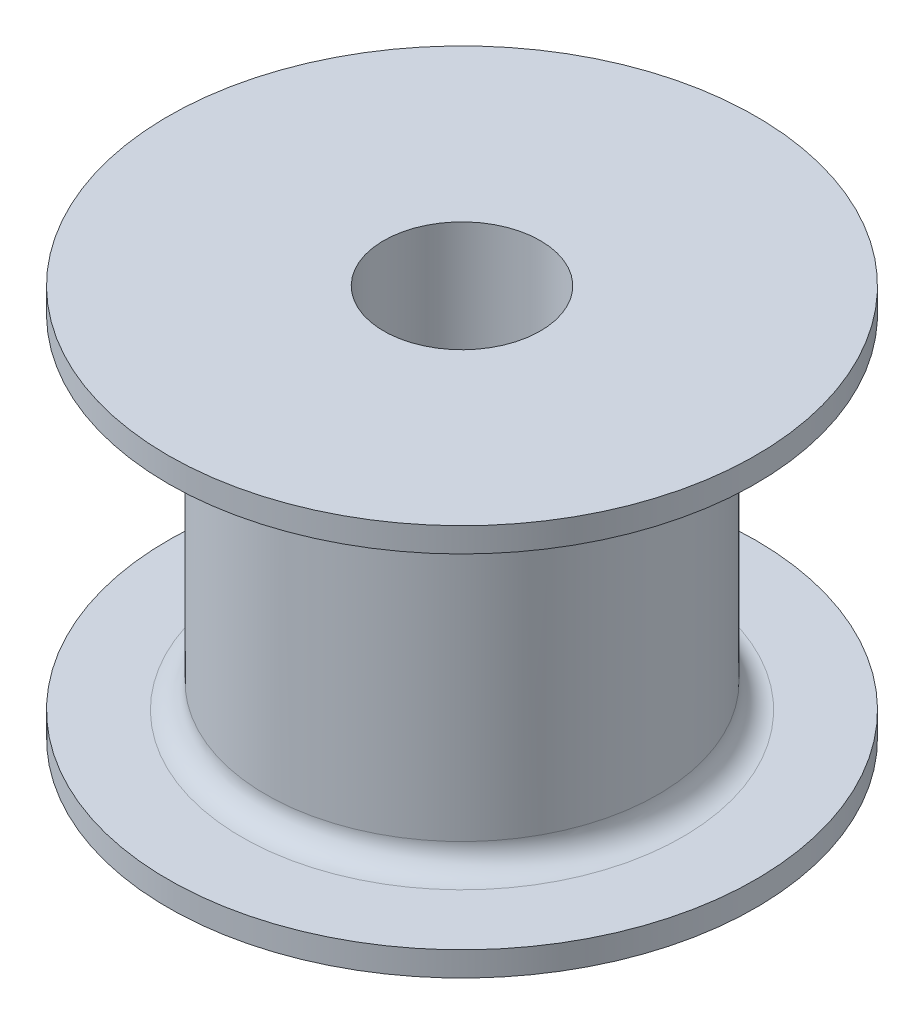
from build123d import *

# Parameters (mm, degrees)
SKETCH1_R            = 4
BOSS_EXTRUDE1_DEPTH  = 7
SKETCH2_R            = 6
BOSS_EXTRUDE2_DEPTH  = 0.5
BOSS_EXTRUDE3_START  = 0.5
SKETCH3_R            = 6
BOSS_EXTRUDE3_DEPTH  = 0.5
M3_CLEARANCE_HOLE1_D = 3.2
FILLET1_R            = 0.5


with BuildPart() as part:
    # Sketch1 → Boss-Extrude1 (new body)
    with BuildSketch(Plane(origin=(0, 0, 0), x_dir=(1, 0, 0), z_dir=(0, 1, 0))):
        with Locations(Location((0, 0, 0), (0, 0, 270))):
            Circle(SKETCH1_R)
    extrude(amount=BOSS_EXTRUDE1_DEPTH)

    # Sketch2 → Boss-Extrude2 (add)
    with BuildSketch(Plane(origin=(0, 7, 0), x_dir=(1, 0, 0), z_dir=(0, 1, 0))):
        with Locations(Location((0, 0, 0), (0, 0, 270))):
            Circle(SKETCH2_R)
    extrude(amount=BOSS_EXTRUDE2_DEPTH)

    # Sketch3 → Boss-Extrude3 (add)
    with BuildSketch(Plane.XZ.offset(BOSS_EXTRUDE3_START)):
        with Locations(Location((0, 0, 0), (0, 0, 90))):
            Circle(SKETCH3_R)
    extrude(amount=-BOSS_EXTRUDE3_DEPTH)

    # M3 Clearance Hole1 (through all)
    with Locations(Plane(origin=(0, -0.5, 0), x_dir=(-1, 0, 0), z_dir=(0, -1, 0))):
        with Locations((0, 0)):
            Hole(M3_CLEARANCE_HOLE1_D / 2)

    # Fillet1
    fillet1_edges = [part.edges().sort_by_distance(p)[0] for p in [
        (0, 7, -4),
        (0, 0, -4),
    ]]
    fillet(fillet1_edges, radius=FILLET1_R)


solid = part.part
